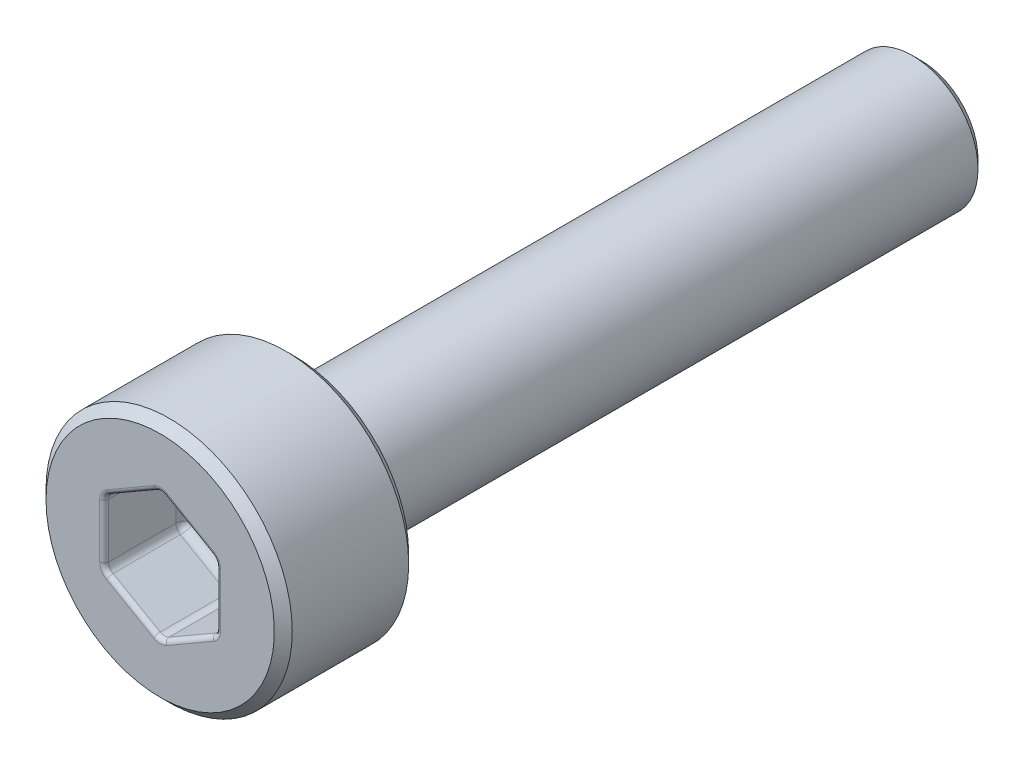
from build123d import *

# Parameters (mm, degrees)
SCHNITT_LINEAR_AUSTRAGEN1_DEPTH = 1.8
FASE1_SIZE                      = 0.2
VERRUNDUNG1_R                   = 0.2
VERRUNDUNG2_R                   = 0.1


with BuildPart() as part:
    # Skizze1 → Rotation1 (revolve)
    with BuildSketch(Plane(origin=(0, 0, 0), x_dir=(0, 0, -1), z_dir=(1, 0, 0))):
        Polygon((-3, 0), (-3, 2.75), (0, 2.75), (0, 1.465), (14, 1.465), (14, 0), align=None)
    revolve(axis=Axis((0, 0, 21.919879518), (0, 0, -1)))

    # Skizze2 → Schnitt-Linear austragen1 (cut)
    with BuildSketch(Plane.XY.offset(3)):
        Polygon((1.25, -0.721687836), (1.25, 0.721687836), (0, 1.443375673), (-1.25, 0.721687836), (-1.25, -0.721687836), (0, -1.443375673), align=None)
    extrude(amount=-SCHNITT_LINEAR_AUSTRAGEN1_DEPTH, mode=Mode.SUBTRACT)

    # Fase1
    fase1_edges = [part.edges().sort_by_distance(p)[0] for p in [
        (0, -2.75, 3),
        (0, -2.75, 0),
        (0, -1.465, -14),
    ]]
    chamfer(fase1_edges, length=FASE1_SIZE)

    # Verrundung1
    verrundung1_edges = [part.edges().sort_by_distance(p)[0] for p in [
        (-0.625, -1.082531755, 1.2),
        (-1.25, 0, 1.2),
        (-0.625, 1.082531755, 1.2),
        (0.625, 1.082531755, 1.2),
        (1.25, 0, 1.2),
        (0.625, -1.082531755, 1.2),
        (-1.25, -0.721687836, 2.1),
        (0, -1.443375673, 2.1),
        (1.25, -0.721687836, 2.1),
        (1.25, 0.721687836, 2.1),
        (0, 1.443375673, 2.1),
        (-1.25, 0.721687836, 2.1),
        (0, -1.465, 0),
    ]]
    fillet(verrundung1_edges, radius=VERRUNDUNG1_R)

    # Verrundung2
    verrundung2_edges = [part.edges().sort_by_distance(p)[0] for p in [
        (1.223205081, -0.706217783, 3),
        (0.625, -1.082531755, 3),
        (0, -1.412435565, 3),
        (-0.625, -1.082531755, 3),
        (-1.223205081, -0.706217783, 3),
        (-1.25, 0, 3),
        (-1.223205081, 0.706217783, 3),
        (-0.625, 1.082531755, 3),
        (0, 1.412435565, 3),
        (0.625, 1.082531755, 3),
        (1.223205081, 0.706217783, 3),
        (1.25, 0, 3),
    ]]
    fillet(verrundung2_edges, radius=VERRUNDUNG2_R)


solid = part.part
